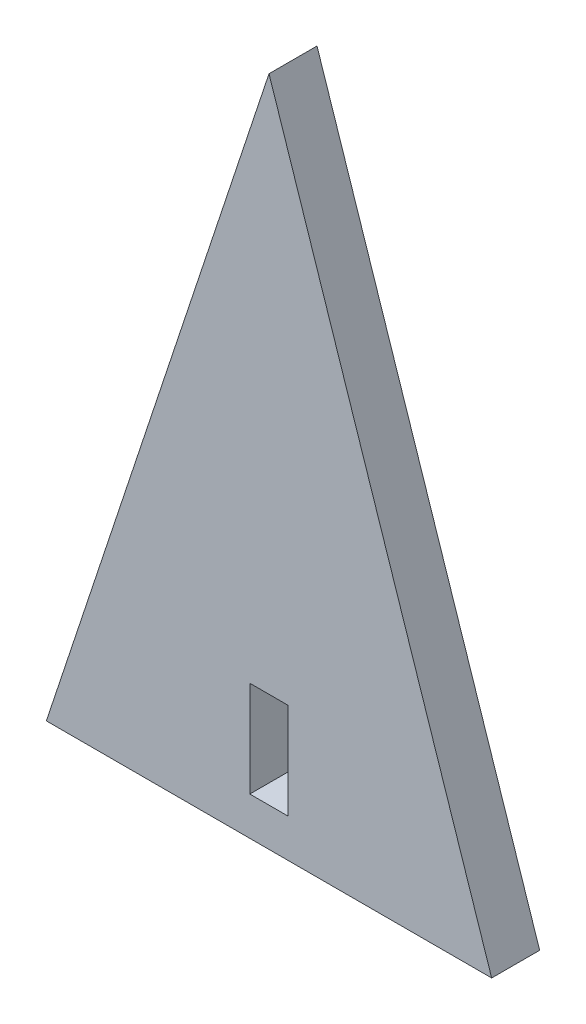
from build123d import *

# Parameters (mm, degrees)
SKETCH2_W           = 2.54
SKETCH2_H           = 6.35
BOSS_EXTRUDE1_DEPTH = 3.175


with BuildPart() as part:
    # Sketch2 → Boss-Extrude1 (new body)
    with BuildSketch(Plane.XY):
        Polygon((-16.084625597, -40.368802078), (-1.352625597, 4.081197922), (13.379374403, -40.368802078), align=None)
        with Locations((-1.352625597, -34.653802078)):
            Rectangle(SKETCH2_W, SKETCH2_H, mode=Mode.SUBTRACT)
    extrude(amount=BOSS_EXTRUDE1_DEPTH)


solid = part.part
